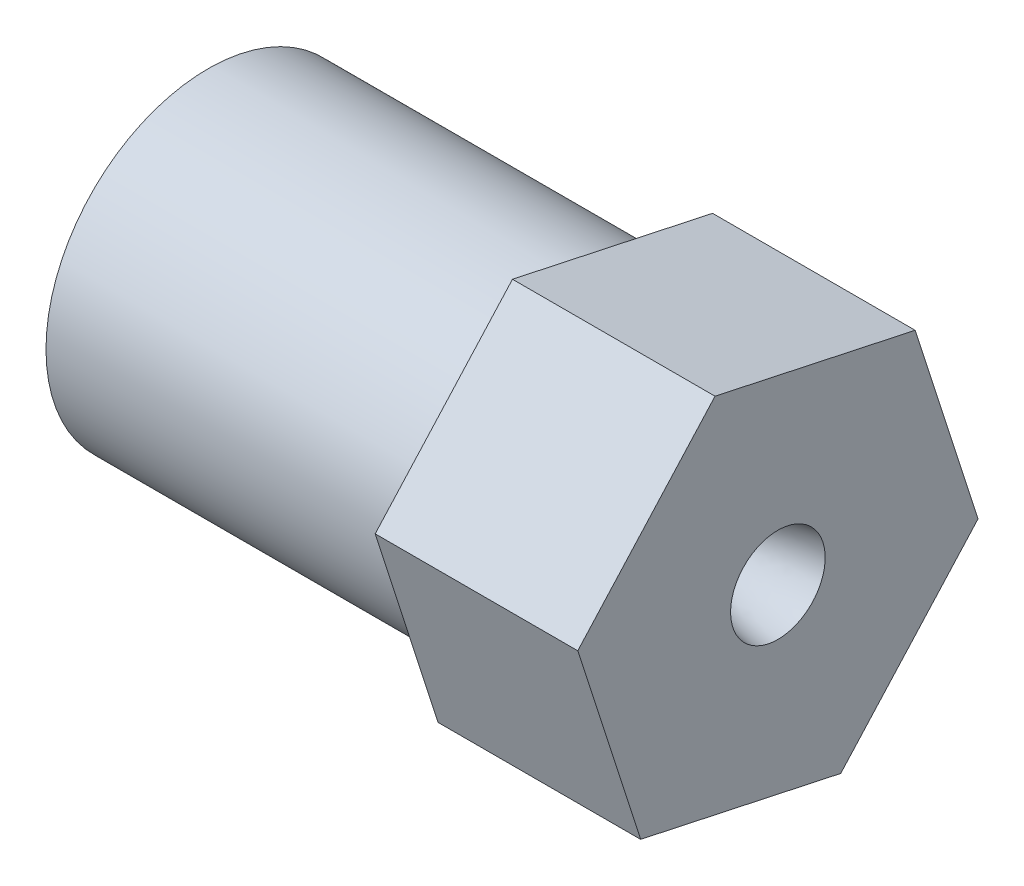
from build123d import *

# Parameters (mm, degrees)
SKETCH4_R           = 10.16
BOSS_EXTRUDE1_DEPTH = 12.7
FILLET1_R           = 0.635


with BuildPart() as part:
    # Sketch1 → Revolve1 (revolve)
    with BuildSketch(Plane.XY, mode=Mode.PRIVATE) as revolve1_sk:
        with BuildLine():
            Line((-2.121320344, 2.878679656), (-2.757704717, 3.51506403))
            ThreePointArc((-2.757704717, 3.51506403), (-3.78774885, 4.203317516), (-5.002768748, 4.445))
            Line((-5.002768748, 4.445), (-13.462, 4.445))
            Line((-13.462, 4.445), (-13.462, 4.699))
            ThreePointArc((-13.462, 4.699), (-13.499197439, 4.788802561), (-13.589, 4.826))
            Line((-13.589, 4.826), (-19.304, 4.826))
            ThreePointArc((-19.304, 4.826), (-19.753012806, 5.011987194), (-19.939, 5.461))
            Line((-19.939, 5.461), (-19.939, 6.8199))
            ThreePointArc((-19.939, 6.8199), (-19.976197439, 6.909702561), (-20.066, 6.9469))
            Line((-20.066, 6.9469), (-24.892, 6.9469))
            Line((-24.892, 6.9469), (-24.892, 7.8994))
            ThreePointArc((-24.892, 7.8994), (-24.929197439, 7.989202561), (-25.019, 8.0264))
            Line((-25.019, 8.0264), (-31.115, 8.0264))
            ThreePointArc((-31.115, 8.0264), (-31.564012806, 8.212387194), (-31.75, 8.6614))
            Line((-31.75, 8.6614), (-31.75, 10.16))
            Line((-31.75, 10.16), (-8.725248841, 10.16))
            Line((-8.725248841, 10.16), (3.974751159, 10.16))
            Line((3.974751159, 10.16), (3.974751159, 2.966479395))
            add(Edge.make_bspline(
                [(3.974751159, 2.966479395), (2.055265637, 2.696713297), (0.273616115, 2.048245903)],
                knots=[0, 0, 0, 1, 1, 1], degree=2))
            ThreePointArc((0.273616115, 2.048245903), (0.138918542, 2.012153798), (0, 2))
            ThreePointArc((0, 2), (-1.148050297, 2.228361402), (-2.121320344, 2.878679656))
        make_face()
    revolve(revolve1_sk.sketch.rotate(Axis((0, 0, 0), (1, 0, 0)), 90), axis=Axis((0, 0, 0), (1, 0, 0)))

    # Sketch4 → Boss-Extrude1 (add)
    with BuildSketch(Plane(origin=(3.974751159, 0, 0), x_dir=(0, 0, -1), z_dir=(1, 0, 0))):
        Polygon((3.940411868, -12.211607701), (12.545768424, -2.693307071), (8.605356556, 9.51830063), (-3.940411868, 12.211607701), (-12.545768424, 2.693307071), (-8.605356556, -9.51830063), align=None)
        with Locations(Location((0, 0, 0), (0, 0, 180))):
            Circle(SKETCH4_R, mode=Mode.SUBTRACT)
    extrude(amount=-BOSS_EXTRUDE1_DEPTH)

    # Fillet1
    fillet1_edges = [part.edges().sort_by_distance(p)[0] for p in [
        (-8.725248841, 0, -10.16),
    ]]
    fillet(fillet1_edges, radius=FILLET1_R)


solid = part.part
